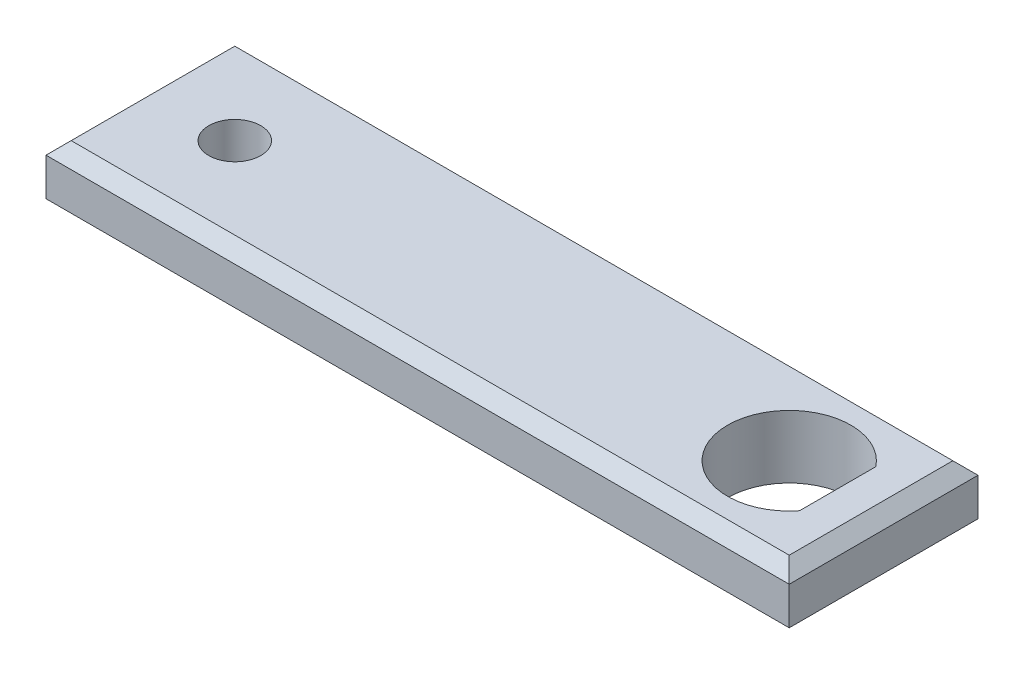
from build123d import *

# Parameters (mm, degrees)
SKETCH1_W          = 75
SKETCH1_H          = 6.35
BASE_EXTRUDE_DEPTH = 19.05
CUT_EXTRUDE1_DEPTH = 78.641644753
SKETCH3_R          = 2.622460094
CUT_EXTRUDE2_DEPTH = 78.641644753
CHAMFER1_SIZE      = 1.27


with BuildPart() as part:
    # Sketch1 → Base-Extrude (new body)
    with BuildSketch(Plane.XY):
        with Locations((37.5, 3.175)):
            Rectangle(SKETCH1_W, SKETCH1_H)
    extrude(amount=BASE_EXTRUDE_DEPTH)

    # Sketch2 → Cut-Extrude1 (cut, through all)
    with BuildSketch(Plane(origin=(0, 6.35, 0), x_dir=(-1, 0, 0), z_dir=(0, 1, 0))):
        with BuildLine():
            Line((-70.3645, 5.67551708), (-70.3645, 13.37448292))
            ThreePointArc((-70.3645, 13.37448292), (-59.252, 9.525), (-70.3645, 5.67551708))
        make_face()
    extrude(amount=-CUT_EXTRUDE1_DEPTH, mode=Mode.SUBTRACT)

    # Sketch3 → Cut-Extrude2 (cut, through all)
    with BuildSketch(Plane(origin=(0, 6.35, 0), x_dir=(-1, 0, 0), z_dir=(0, 1, 0))):
        with Locations((-9.525, 9.525)):
            Circle(SKETCH3_R)
    extrude(amount=-CUT_EXTRUDE2_DEPTH, mode=Mode.SUBTRACT)

    # Chamfer1
    chamfer1_edges = [part.edges().sort_by_distance(p)[0] for p in [
        (37.5, 0, 19.05),
        (37.5, 0, 0),
        (37.5, 6.35, 0),
        (37.5, 6.35, 19.05),
        (0, 0, 9.525),
        (75, 0, 9.525),
        (75, 6.35, 9.525),
        (0, 6.35, 9.525),
    ]]
    chamfer(chamfer1_edges, length=CHAMFER1_SIZE)


solid = part.part
